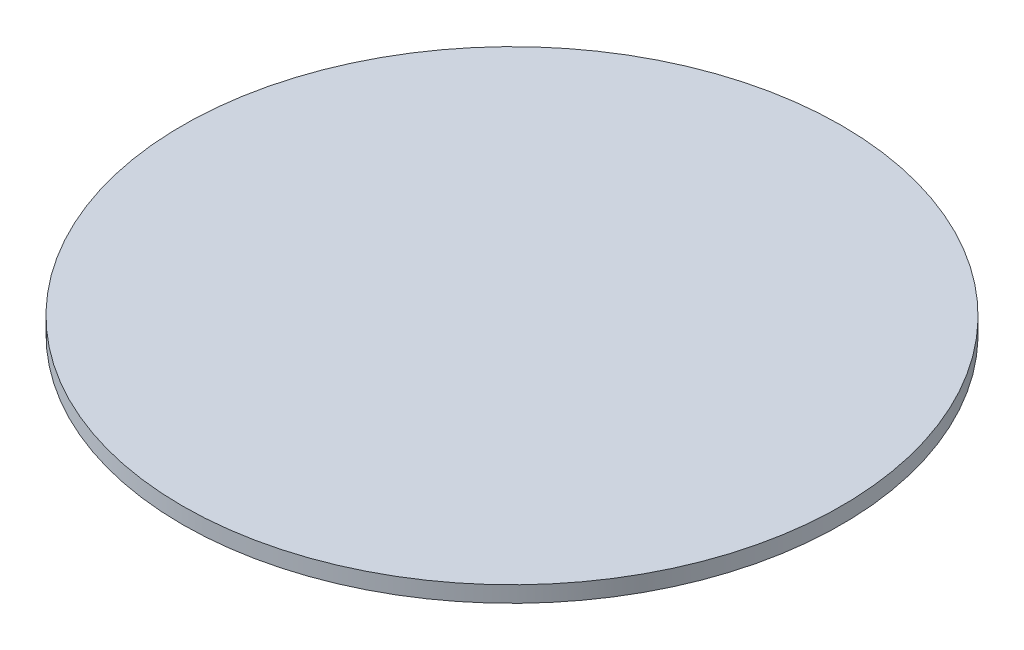
from build123d import *

# Parameters (mm, degrees)
SKETCH1_R           = 102.5
BOSS_EXTRUDE1_DEPTH = 5


with BuildPart() as part:
    # Sketch1 → Boss-Extrude1 (new body)
    with BuildSketch(Plane(origin=(0, 0, 0), x_dir=(1, 0, 0), z_dir=(0, 1, 0))):
        with Locations(Location((0, 0, 0), (0, 0, 270))):
            Circle(SKETCH1_R)
    extrude(amount=BOSS_EXTRUDE1_DEPTH)


solid = part.part
